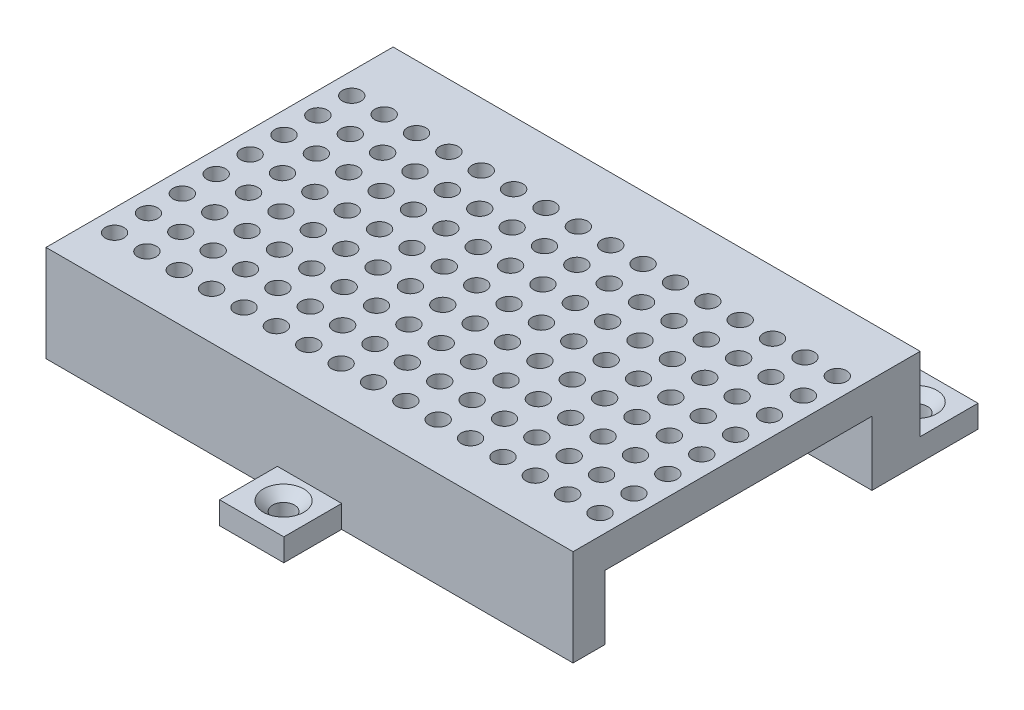
from build123d import *

# Parameters (mm, degrees)
ESQUISSE1_W                                    = 82
ESQUISSE1_H                                    = 54
BOSS_EXTRU_1_DEPTH                             = 5
ESQUISSE2_W                                    = 82
ESQUISSE2_H                                    = 15
BOSS_EXTRU_2_DEPTH                             = 5
ESQUISSE3_W                                    = 10
ESQUISSE3_H                                    = 7.5
BOSS_EXTRU_3_DEPTH                             = 10
ESQUISSE4_W                                    = 10
ESQUISSE4_H                                    = 3.5
BOSS_EXTRU_4_DEPTH                             = 9
FRAISAGE_POUR_VIS_T_TE_FRAIS_E_M31_D           = 3.4
FRAISAGE_POUR_VIS_T_TE_FRAIS_E_M31_CSINK_D     = 6.3
FRAISAGE_POUR_VIS_T_TE_FRAIS_E_M31_CSINK_ANGLE = 90
ESQUISSE7_W                                    = 10
ESQUISSE7_H                                    = 3.5
BOSS_EXTRU_5_DEPTH                             = 9
FRAISAGE_POUR_VIS_T_TE_FRAIS_E_M32_D           = 3.4
FRAISAGE_POUR_VIS_T_TE_FRAIS_E_M32_CSINK_D     = 6.3
FRAISAGE_POUR_VIS_T_TE_FRAIS_E_M32_CSINK_ANGLE = 90
ESQUISSE10_R                                   = 1.450938335
ENL_V_MAT_EXTRU_1_DEPTH                        = 9


with BuildPart() as part:
    # Esquisse1 → Boss.-Extru.1 (new body)
    with BuildSketch(Plane(origin=(0, 0, 0), x_dir=(1, 0, 0), z_dir=(0, 1, 0))):
        with Locations((-2.275261324, -2.163763066)):
            Rectangle(ESQUISSE1_W, ESQUISSE1_H)
    extrude(amount=BOSS_EXTRU_1_DEPTH)

    # Esquisse2 → Boss.-Extru.2 (add)
    with BuildSketch(Plane.XY.offset(29.163763066)):
        with Locations((-2.275261324, -2.5)):
            Rectangle(ESQUISSE2_W, ESQUISSE2_H)
    extrude(amount=-BOSS_EXTRU_2_DEPTH)

    # Esquisse3 → Boss.-Extru.3 (add)
    with BuildSketch(Plane.XZ):
        with Locations((-38.275261324, -21.086236934)):
            Rectangle(ESQUISSE3_W, ESQUISSE3_H)
        with Locations((33.724738676, -21.086236934)):
            Rectangle(ESQUISSE3_W, ESQUISSE3_H)
    extrude(amount=BOSS_EXTRU_3_DEPTH)

    # Esquisse4 → Boss.-Extru.4 (add)
    with BuildSketch(Plane(origin=(0, 0, -24.836236934), x_dir=(-1, 0, 0), z_dir=(0, 0, -1))):
        with Locations((-33.724738676, -8.25)):
            Rectangle(ESQUISSE4_W, ESQUISSE4_H)
        with Locations((38.275261324, -8.25)):
            Rectangle(ESQUISSE4_W, ESQUISSE4_H)
    extrude(amount=BOSS_EXTRU_4_DEPTH)

    # Fraisage pour vis à tête fraisée M31 (through all)
    with Locations(Plane(origin=(0, -6.5, 0), x_dir=(1, 0, 0), z_dir=(0, 1, 0))):
        with Locations((-38.417839522, 29.233039207), (33.783262533, 29.233039207)):
            CounterSinkHole(FRAISAGE_POUR_VIS_T_TE_FRAIS_E_M31_D / 2, FRAISAGE_POUR_VIS_T_TE_FRAIS_E_M31_CSINK_D / 2, counter_sink_angle=FRAISAGE_POUR_VIS_T_TE_FRAIS_E_M31_CSINK_ANGLE)

    # Esquisse7 → Boss.-Extru.5 (add)
    with BuildSketch(Plane.XY.offset(29.163763066)):
        with Locations((-2.275261324, -8.25)):
            Rectangle(ESQUISSE7_W, ESQUISSE7_H)
    extrude(amount=BOSS_EXTRU_5_DEPTH)

    # Fraisage pour vis à tête fraisée M32 (through all)
    with Locations(Plane(origin=(0, -6.5, 0), x_dir=(1, 0, 0), z_dir=(0, 1, 0))):
        with Locations((-2.179752597, -33.299608063)):
            CounterSinkHole(FRAISAGE_POUR_VIS_T_TE_FRAIS_E_M32_D / 2, FRAISAGE_POUR_VIS_T_TE_FRAIS_E_M32_CSINK_D / 2, counter_sink_angle=FRAISAGE_POUR_VIS_T_TE_FRAIS_E_M32_CSINK_ANGLE)

    # Esquisse10 → Enlèv. mat.-Extru.1 (cut)
    with BuildSketch(Plane(origin=(0, 5, 0), x_dir=(1, 0, 0), z_dir=(0, 1, 0))):
        with Locations(Location((-39.916872012, 15.052234019, 0), (0, 0, 270))):
            Circle(ESQUISSE10_R)
        with Locations(Location((-34.881252555, 15.052234019, 0), (0, 0, 270))):
            Circle(ESQUISSE10_R)
        with Locations(Location((-29.845633097, 15.052234019, 0), (0, 0, 270))):
            Circle(ESQUISSE10_R)
        with Locations(Location((-24.810013639, 15.052234019, 0), (0, 0, 270))):
            Circle(ESQUISSE10_R)
        with Locations(Location((-19.774394181, 15.052234019, 0), (0, 0, 270))):
            Circle(ESQUISSE10_R)
        with Locations(Location((-14.738774724, 15.052234019, 0), (0, 0, 270))):
            Circle(ESQUISSE10_R)
        with Locations(Location((-9.703155266, 15.052234019, 0), (0, 0, 270))):
            Circle(ESQUISSE10_R)
        with Locations(Location((-4.667535808, 15.052234019, 0), (0, 0, 270))):
            Circle(ESQUISSE10_R)
        with Locations(Location((0.368083649, 15.052234019, 0), (0, 0, 270))):
            Circle(ESQUISSE10_R)
        with Locations(Location((5.403703107, 15.052234019, 0), (0, 0, 270))):
            Circle(ESQUISSE10_R)
        with Locations(Location((10.439322565, 15.052234019, 0), (0, 0, 270))):
            Circle(ESQUISSE10_R)
        with Locations(Location((15.474942022, 15.052234019, 0), (0, 0, 270))):
            Circle(ESQUISSE10_R)
        with Locations(Location((20.51056148, 15.052234019, 0), (0, 0, 270))):
            Circle(ESQUISSE10_R)
        with Locations(Location((25.546180938, 15.052234019, 0), (0, 0, 270))):
            Circle(ESQUISSE10_R)
        with Locations(Location((30.581800396, 15.052234019, 0), (0, 0, 270))):
            Circle(ESQUISSE10_R)
        with Locations(Location((35.617419853, 15.052234019, 0), (0, 0, 270))):
            Circle(ESQUISSE10_R)
        with Locations(Location((-34.881252555, 9.779215887, 0), (0, 0, 270))):
            Circle(ESQUISSE10_R)
        with Locations(Location((-29.845633097, 9.779215887, 0), (0, 0, 270))):
            Circle(ESQUISSE10_R)
        with Locations(Location((-24.810013639, 9.779215887, 0), (0, 0, 270))):
            Circle(ESQUISSE10_R)
        with Locations(Location((-19.774394181, 9.779215887, 0), (0, 0, 270))):
            Circle(ESQUISSE10_R)
        with Locations(Location((-14.738774724, 9.779215887, 0), (0, 0, 270))):
            Circle(ESQUISSE10_R)
        with Locations(Location((-9.703155266, 9.779215887, 0), (0, 0, 270))):
            Circle(ESQUISSE10_R)
        with Locations(Location((-4.667535808, 9.779215887, 0), (0, 0, 270))):
            Circle(ESQUISSE10_R)
        with Locations(Location((0.368083649, 9.779215887, 0), (0, 0, 270))):
            Circle(ESQUISSE10_R)
        with Locations(Location((5.403703107, 9.779215887, 0), (0, 0, 270))):
            Circle(ESQUISSE10_R)
        with Locations(Location((10.439322565, 9.779215887, 0), (0, 0, 270))):
            Circle(ESQUISSE10_R)
        with Locations(Location((15.474942022, 9.779215887, 0), (0, 0, 270))):
            Circle(ESQUISSE10_R)
        with Locations(Location((20.51056148, 9.779215887, 0), (0, 0, 270))):
            Circle(ESQUISSE10_R)
        with Locations(Location((25.546180938, 9.779215887, 0), (0, 0, 270))):
            Circle(ESQUISSE10_R)
        with Locations(Location((30.581800396, 9.779215887, 0), (0, 0, 270))):
            Circle(ESQUISSE10_R)
        with Locations(Location((35.617419853, 9.779215887, 0), (0, 0, 270))):
            Circle(ESQUISSE10_R)
        with Locations(Location((-34.881252555, 4.506197755, 0), (0, 0, 270))):
            Circle(ESQUISSE10_R)
        with Locations(Location((-29.845633097, 4.506197755, 0), (0, 0, 270))):
            Circle(ESQUISSE10_R)
        with Locations(Location((-24.810013639, 4.506197755, 0), (0, 0, 270))):
            Circle(ESQUISSE10_R)
        with Locations(Location((-19.774394181, 4.506197755, 0), (0, 0, 270))):
            Circle(ESQUISSE10_R)
        with Locations(Location((-14.738774724, 4.506197755, 0), (0, 0, 270))):
            Circle(ESQUISSE10_R)
        with Locations(Location((-9.703155266, 4.506197755, 0), (0, 0, 270))):
            Circle(ESQUISSE10_R)
        with Locations(Location((-4.667535808, 4.506197755, 0), (0, 0, 270))):
            Circle(ESQUISSE10_R)
        with Locations(Location((0.368083649, 4.506197755, 0), (0, 0, 270))):
            Circle(ESQUISSE10_R)
        with Locations(Location((5.403703107, 4.506197755, 0), (0, 0, 270))):
            Circle(ESQUISSE10_R)
        with Locations(Location((10.439322565, 4.506197755, 0), (0, 0, 270))):
            Circle(ESQUISSE10_R)
        with Locations(Location((15.474942022, 4.506197755, 0), (0, 0, 270))):
            Circle(ESQUISSE10_R)
        with Locations(Location((20.51056148, 4.506197755, 0), (0, 0, 270))):
            Circle(ESQUISSE10_R)
        with Locations(Location((25.546180938, 4.506197755, 0), (0, 0, 270))):
            Circle(ESQUISSE10_R)
        with Locations(Location((30.581800396, 4.506197755, 0), (0, 0, 270))):
            Circle(ESQUISSE10_R)
        with Locations(Location((35.617419853, 4.506197755, 0), (0, 0, 270))):
            Circle(ESQUISSE10_R)
        with Locations(Location((-34.881252555, -0.766820377, 0), (0, 0, 270))):
            Circle(ESQUISSE10_R)
        with Locations(Location((-29.845633097, -0.766820377, 0), (0, 0, 270))):
            Circle(ESQUISSE10_R)
        with Locations(Location((-24.810013639, -0.766820377, 0), (0, 0, 270))):
            Circle(ESQUISSE10_R)
        with Locations(Location((-19.774394181, -0.766820377, 0), (0, 0, 270))):
            Circle(ESQUISSE10_R)
        with Locations(Location((-14.738774724, -0.766820377, 0), (0, 0, 270))):
            Circle(ESQUISSE10_R)
        with Locations(Location((-9.703155266, -0.766820377, 0), (0, 0, 270))):
            Circle(ESQUISSE10_R)
        with Locations(Location((-4.667535808, -0.766820377, 0), (0, 0, 270))):
            Circle(ESQUISSE10_R)
        with Locations(Location((0.368083649, -0.766820377, 0), (0, 0, 270))):
            Circle(ESQUISSE10_R)
        with Locations(Location((5.403703107, -0.766820377, 0), (0, 0, 270))):
            Circle(ESQUISSE10_R)
        with Locations(Location((10.439322565, -0.766820377, 0), (0, 0, 270))):
            Circle(ESQUISSE10_R)
        with Locations(Location((15.474942022, -0.766820377, 0), (0, 0, 270))):
            Circle(ESQUISSE10_R)
        with Locations(Location((20.51056148, -0.766820377, 0), (0, 0, 270))):
            Circle(ESQUISSE10_R)
        with Locations(Location((25.546180938, -0.766820377, 0), (0, 0, 270))):
            Circle(ESQUISSE10_R)
        with Locations(Location((30.581800396, -0.766820377, 0), (0, 0, 270))):
            Circle(ESQUISSE10_R)
        with Locations(Location((35.617419853, -0.766820377, 0), (0, 0, 270))):
            Circle(ESQUISSE10_R)
        with Locations(Location((-34.881252555, -6.039838509, 0), (0, 0, 270))):
            Circle(ESQUISSE10_R)
        with Locations(Location((-29.845633097, -6.039838509, 0), (0, 0, 270))):
            Circle(ESQUISSE10_R)
        with Locations(Location((-24.810013639, -6.039838509, 0), (0, 0, 270))):
            Circle(ESQUISSE10_R)
        with Locations(Location((-19.774394181, -6.039838509, 0), (0, 0, 270))):
            Circle(ESQUISSE10_R)
        with Locations(Location((-14.738774724, -6.039838509, 0), (0, 0, 270))):
            Circle(ESQUISSE10_R)
        with Locations(Location((-9.703155266, -6.039838509, 0), (0, 0, 270))):
            Circle(ESQUISSE10_R)
        with Locations(Location((-4.667535808, -6.039838509, 0), (0, 0, 270))):
            Circle(ESQUISSE10_R)
        with Locations(Location((0.368083649, -6.039838509, 0), (0, 0, 270))):
            Circle(ESQUISSE10_R)
        with Locations(Location((5.403703107, -6.039838509, 0), (0, 0, 270))):
            Circle(ESQUISSE10_R)
        with Locations(Location((10.439322565, -6.039838509, 0), (0, 0, 270))):
            Circle(ESQUISSE10_R)
        with Locations(Location((15.474942022, -6.039838509, 0), (0, 0, 270))):
            Circle(ESQUISSE10_R)
        with Locations(Location((20.51056148, -6.039838509, 0), (0, 0, 270))):
            Circle(ESQUISSE10_R)
        with Locations(Location((25.546180938, -6.039838509, 0), (0, 0, 270))):
            Circle(ESQUISSE10_R)
        with Locations(Location((30.581800396, -6.039838509, 0), (0, 0, 270))):
            Circle(ESQUISSE10_R)
        with Locations(Location((35.617419853, -6.039838509, 0), (0, 0, 270))):
            Circle(ESQUISSE10_R)
        with Locations(Location((-34.881252555, -11.312856641, 0), (0, 0, 270))):
            Circle(ESQUISSE10_R)
        with Locations(Location((-29.845633097, -11.312856641, 0), (0, 0, 270))):
            Circle(ESQUISSE10_R)
        with Locations(Location((-24.810013639, -11.312856641, 0), (0, 0, 270))):
            Circle(ESQUISSE10_R)
        with Locations(Location((-19.774394181, -11.312856641, 0), (0, 0, 270))):
            Circle(ESQUISSE10_R)
        with Locations(Location((-14.738774724, -11.312856641, 0), (0, 0, 270))):
            Circle(ESQUISSE10_R)
        with Locations(Location((-9.703155266, -11.312856641, 0), (0, 0, 270))):
            Circle(ESQUISSE10_R)
        with Locations(Location((-4.667535808, -11.312856641, 0), (0, 0, 270))):
            Circle(ESQUISSE10_R)
        with Locations(Location((0.368083649, -11.312856641, 0), (0, 0, 270))):
            Circle(ESQUISSE10_R)
        with Locations(Location((5.403703107, -11.312856641, 0), (0, 0, 270))):
            Circle(ESQUISSE10_R)
        with Locations(Location((10.439322565, -11.312856641, 0), (0, 0, 270))):
            Circle(ESQUISSE10_R)
        with Locations(Location((15.474942022, -11.312856641, 0), (0, 0, 270))):
            Circle(ESQUISSE10_R)
        with Locations(Location((20.51056148, -11.312856641, 0), (0, 0, 270))):
            Circle(ESQUISSE10_R)
        with Locations(Location((25.546180938, -11.312856641, 0), (0, 0, 270))):
            Circle(ESQUISSE10_R)
        with Locations(Location((30.581800396, -11.312856641, 0), (0, 0, 270))):
            Circle(ESQUISSE10_R)
        with Locations(Location((35.617419853, -11.312856641, 0), (0, 0, 270))):
            Circle(ESQUISSE10_R)
        with Locations(Location((-34.881252555, -16.585874773, 0), (0, 0, 270))):
            Circle(ESQUISSE10_R)
        with Locations(Location((-29.845633097, -16.585874773, 0), (0, 0, 270))):
            Circle(ESQUISSE10_R)
        with Locations(Location((-24.810013639, -16.585874773, 0), (0, 0, 270))):
            Circle(ESQUISSE10_R)
        with Locations(Location((-19.774394181, -16.585874773, 0), (0, 0, 270))):
            Circle(ESQUISSE10_R)
        with Locations(Location((-14.738774724, -16.585874773, 0), (0, 0, 270))):
            Circle(ESQUISSE10_R)
        with Locations(Location((-9.703155266, -16.585874773, 0), (0, 0, 270))):
            Circle(ESQUISSE10_R)
        with Locations(Location((-4.667535808, -16.585874773, 0), (0, 0, 270))):
            Circle(ESQUISSE10_R)
        with Locations(Location((0.368083649, -16.585874773, 0), (0, 0, 270))):
            Circle(ESQUISSE10_R)
        with Locations(Location((5.403703107, -16.585874773, 0), (0, 0, 270))):
            Circle(ESQUISSE10_R)
        with Locations(Location((10.439322565, -16.585874773, 0), (0, 0, 270))):
            Circle(ESQUISSE10_R)
        with Locations(Location((15.474942022, -16.585874773, 0), (0, 0, 270))):
            Circle(ESQUISSE10_R)
        with Locations(Location((20.51056148, -16.585874773, 0), (0, 0, 270))):
            Circle(ESQUISSE10_R)
        with Locations(Location((25.546180938, -16.585874773, 0), (0, 0, 270))):
            Circle(ESQUISSE10_R)
        with Locations(Location((30.581800396, -16.585874773, 0), (0, 0, 270))):
            Circle(ESQUISSE10_R)
        with Locations(Location((35.617419853, -16.585874773, 0), (0, 0, 270))):
            Circle(ESQUISSE10_R)
        with Locations(Location((-34.881252555, -21.858892905, 0), (0, 0, 270))):
            Circle(ESQUISSE10_R)
        with Locations(Location((-29.845633097, -21.858892905, 0), (0, 0, 270))):
            Circle(ESQUISSE10_R)
        with Locations(Location((-24.810013639, -21.858892905, 0), (0, 0, 270))):
            Circle(ESQUISSE10_R)
        with Locations(Location((-19.774394181, -21.858892905, 0), (0, 0, 270))):
            Circle(ESQUISSE10_R)
        with Locations(Location((-14.738774724, -21.858892905, 0), (0, 0, 270))):
            Circle(ESQUISSE10_R)
        with Locations(Location((-9.703155266, -21.858892905, 0), (0, 0, 270))):
            Circle(ESQUISSE10_R)
        with Locations(Location((-4.667535808, -21.858892905, 0), (0, 0, 270))):
            Circle(ESQUISSE10_R)
        with Locations(Location((0.368083649, -21.858892905, 0), (0, 0, 270))):
            Circle(ESQUISSE10_R)
        with Locations(Location((5.403703107, -21.858892905, 0), (0, 0, 270))):
            Circle(ESQUISSE10_R)
        with Locations(Location((10.439322565, -21.858892905, 0), (0, 0, 270))):
            Circle(ESQUISSE10_R)
        with Locations(Location((15.474942022, -21.858892905, 0), (0, 0, 270))):
            Circle(ESQUISSE10_R)
        with Locations(Location((20.51056148, -21.858892905, 0), (0, 0, 270))):
            Circle(ESQUISSE10_R)
        with Locations(Location((25.546180938, -21.858892905, 0), (0, 0, 270))):
            Circle(ESQUISSE10_R)
        with Locations(Location((30.581800396, -21.858892905, 0), (0, 0, 270))):
            Circle(ESQUISSE10_R)
        with Locations(Location((35.617419853, -21.858892905, 0), (0, 0, 270))):
            Circle(ESQUISSE10_R)
        with Locations(Location((-39.916872012, 9.779215887, 0), (0, 0, 270))):
            Circle(ESQUISSE10_R)
        with Locations(Location((-39.916872012, 4.506197755, 0), (0, 0, 270))):
            Circle(ESQUISSE10_R)
        with Locations(Location((-39.916872012, -0.766820377, 0), (0, 0, 270))):
            Circle(ESQUISSE10_R)
        with Locations(Location((-39.916872012, -6.039838509, 0), (0, 0, 270))):
            Circle(ESQUISSE10_R)
        with Locations(Location((-39.916872012, -11.312856641, 0), (0, 0, 270))):
            Circle(ESQUISSE10_R)
        with Locations(Location((-39.916872012, -16.585874773, 0), (0, 0, 270))):
            Circle(ESQUISSE10_R)
        with Locations(Location((-39.916872012, -21.858892905, 0), (0, 0, 270))):
            Circle(ESQUISSE10_R)
    extrude(amount=-ENL_V_MAT_EXTRU_1_DEPTH, mode=Mode.SUBTRACT)


solid = part.part
